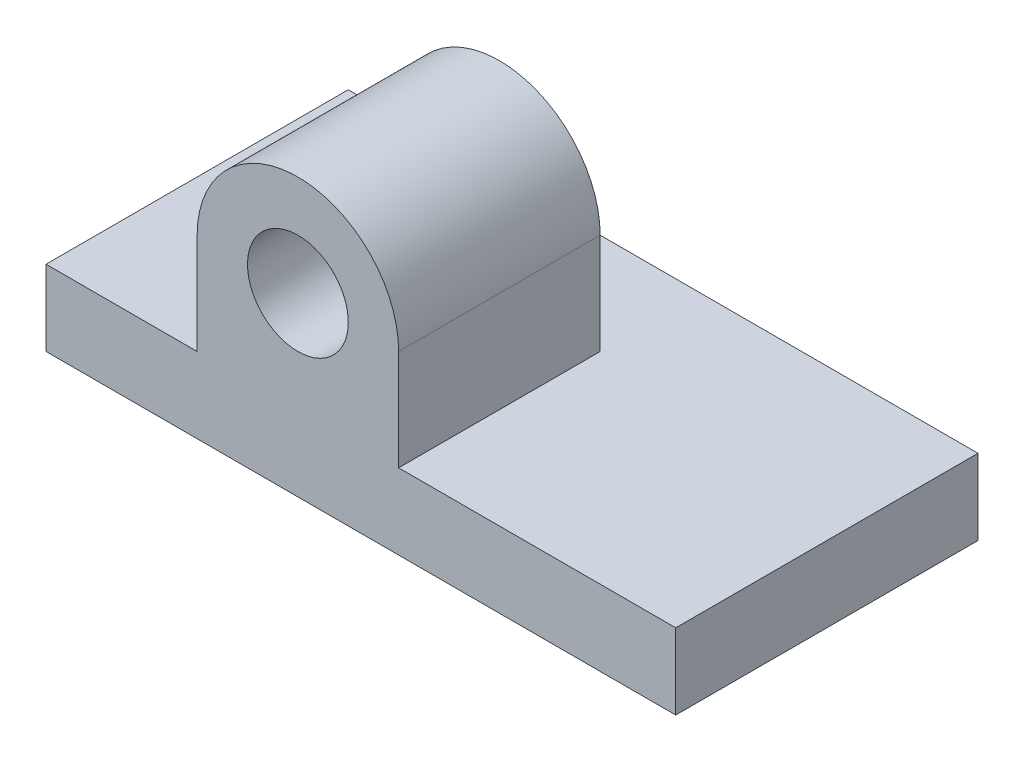
from build123d import *

# Parameters (mm, degrees)
BOSS_EXTRUDE1_DEPTH = 60
SKETCH1_3_R         = 10
BOSS_EXTRUDE2_DEPTH = 40


with BuildPart() as part:
    # Sketch1 → Boss-Extrude1 (new body)
    with BuildSketch(Plane.XY):
        Polygon((70, 15), (30, 15), (0, 15), (0, 0), (125, 0), (125, 15), align=None)
    extrude(amount=-BOSS_EXTRUDE1_DEPTH)

    # Sketch1<3> → Boss-Extrude2 (add)
    with BuildSketch(Plane.XY):
        with BuildLine():
            Line((30, 35), (30, 15))
            Line((30, 15), (70, 15))
            Line((70, 15), (70, 35))
            ThreePointArc((70, 35), (50, 55), (30, 35))
        make_face()
        with Locations((50, 35)):
            Circle(SKETCH1_3_R, mode=Mode.SUBTRACT)
    extrude(amount=-BOSS_EXTRUDE2_DEPTH)


solid = part.part
